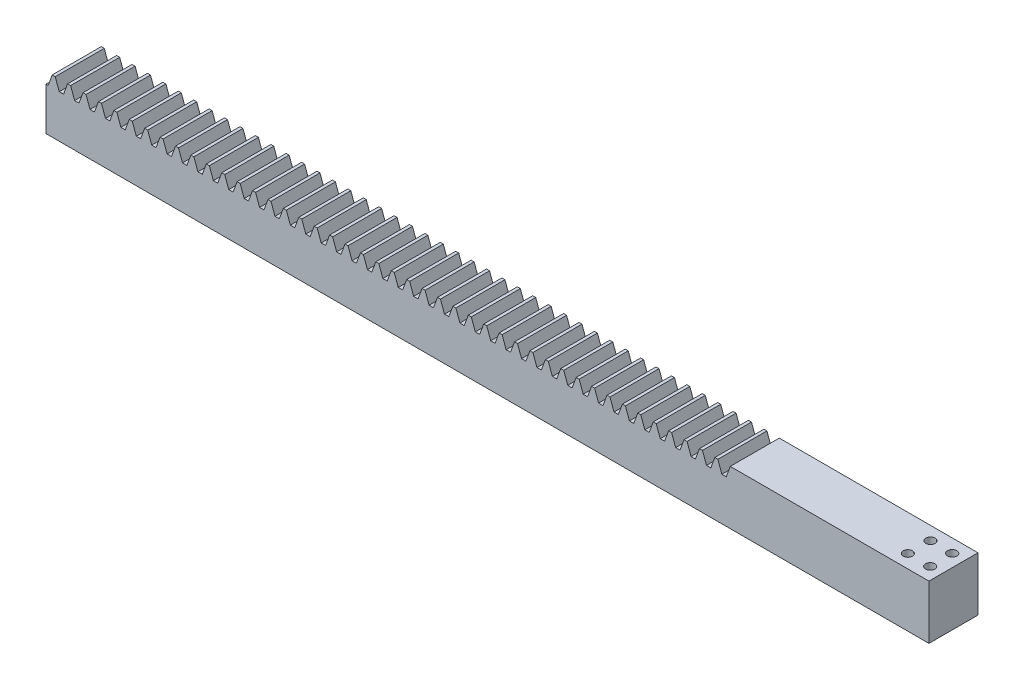
from build123d import *

# Parameters (mm, degrees)
BLANKSKE_W          = 140
BLANKSKE_H          = 11
BLANK_DEPTH         = 10
TOOTHCUTSIM_DEPTH   = 141.78707327
TEETHCUTS_COUNT     = 46
TEETHCUTS_PITCH     = 3.14159265
SKETCH1_W           = 10
SKETCH1_H           = 11
BOSS_EXTRUDE1_DEPTH = 40
SKETCH3_R           = 0.95
CUT_EXTRUDE1_DEPTH  = 181.612845612


with BuildPart() as part:
    # BlankSke → Blank (new body)
    with BuildSketch(Plane.XY):
        with Locations((70, 5.5)):
            Rectangle(BLANKSKE_W, BLANKSKE_H)
    extrude(amount=-BLANK_DEPTH)

    # TooCutSkeSim → ToothCutSim (cut, through all)
    with BuildSketch(Plane.XY):
        Polygon((0.44443537, 8.75), (-0.44443537, 8.75), (-1.272613241, 11.0254), (1.272613241, 11.0254), align=None)
    toothcutsim = extrude(amount=-TOOTHCUTSIM_DEPTH, mode=Mode.SUBTRACT)

    # TeethCuts: ToothCutSim ×46
    with Locations(*[(i * TEETHCUTS_PITCH, 0, 0) for i in range(1, TEETHCUTS_COUNT)]):
        add(toothcutsim, mode=Mode.SUBTRACT)

    # Sketch1 → Boss-Extrude1 (add)
    with BuildSketch(Plane(origin=(140, 0, 0), x_dir=(0, 0, -1), z_dir=(1, 0, 0))):
        with Locations((5, 5.5)):
            Rectangle(SKETCH1_W, SKETCH1_H)
    extrude(amount=BOSS_EXTRUDE1_DEPTH)

    # Sketch3 → Cut-Extrude1 (cut, through all)
    with BuildSketch(Plane(origin=(0, 11, 0), x_dir=(1, 0, 0), z_dir=(0, 1, 0))):
        with Locations((173.03, 7.275)):
            Circle(SKETCH3_R)
        with Locations((177.47, 7.275)):
            Circle(SKETCH3_R)
        with Locations((177.53, 2.725)):
            Circle(SKETCH3_R)
        with Locations((172.97, 2.725)):
            Circle(SKETCH3_R)
    extrude(amount=-CUT_EXTRUDE1_DEPTH, mode=Mode.SUBTRACT)


solid = part.part
